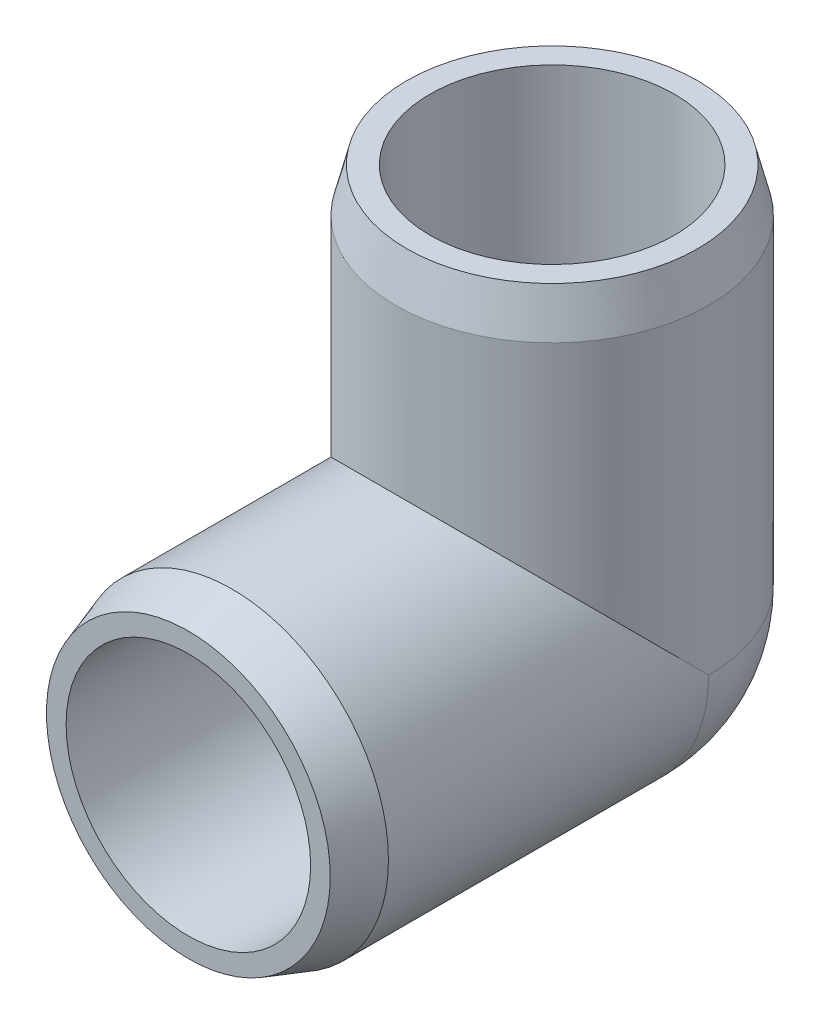
from build123d import *

# Parameters (mm, degrees)
BOSS_EXTRUDE2_REACH      = 67.644
BOSS_EXTRUDE2_END_RADIUS = 13.6525
SKETCH5_R                = 13.6525
SKETCH5_R_2              = 10.668
SKETCH6_R                = 10.668
CUT_EXTRUDE1_DEPTH       = 43.688
CUT_EXTRUDE2_START       = 44.196
SKETCH7_R                = 10.668
CUT_EXTRUDE2_DEPTH       = 44.196
SKETCH8_W                = 1.27
SKETCH8_H                = 1.905
SKETCH9_W                = 1.905
SKETCH9_H                = 1.27


with BuildPart() as part:
    # Sketch2 → Revolve1 (revolve)
    with BuildSketch(Plane.XY):
        with BuildLine():
            Line((13.6525, 13.6525), (13.6525, 45.4025))
            Line((13.6525, 45.4025), (10.668, 45.4025))
            Line((10.668, 45.4025), (10.668, 13.6525))
            ThreePointArc((10.668, 13.6525), (7.543415142, 6.109084858), (0, 2.9845))
            Line((0, 2.9845), (0, 0))
            ThreePointArc((0, 0), (9.65377533, 3.99872467), (13.6525, 13.6525))
        make_face()
    revolve(axis=Axis((0, 50.454853333, 0), (0, -1, 0)))

    # Boss-Extrude2: up to this sphere (the profile starts outside it)
    boss_extrude2_end = Location((0, 13.6525, 0)) * Sphere(BOSS_EXTRUDE2_END_RADIUS, mode=Mode.PRIVATE)
    # Sketch5 → Boss-Extrude2 (add, up to the surface)
    with BuildSketch(Plane(origin=(0, 0, 31.75), x_dir=(-1, 0, 0), z_dir=(0, 0, -1)), mode=Mode.PRIVATE) as boss_extrude2_sk1:
        with Locations((0, 13.6525)):
            Circle(SKETCH5_R)
        with Locations((0, 13.6525)):
            Circle(SKETCH5_R_2, mode=Mode.SUBTRACT)
    boss_extrude2_tool1 = extrude(boss_extrude2_sk1.sketch, amount=BOSS_EXTRUDE2_REACH, mode=Mode.PRIVATE) - boss_extrude2_end
    add(boss_extrude2_tool1.solids().sort_by_distance((13.266349, 13.6525, 31.75))[0])

    # Sketch6 → Cut-Extrude1 (cut)
    with BuildSketch(Plane(origin=(0, 13.6525, 0), x_dir=(1, 0, 0), z_dir=(0, 1, 0))):
        with Locations(Location((0, 0, 0), (0, 0, 270))):
            Circle(SKETCH6_R)
    extrude(amount=CUT_EXTRUDE1_DEPTH, mode=Mode.SUBTRACT)

    # Sketch7 → Cut-Extrude2 (cut)
    with BuildSketch(Plane.XY.offset(CUT_EXTRUDE2_START)):
        with Locations(Location((0, 13.6525, 0), (0, 0, 180))):
            Circle(SKETCH7_R)
    extrude(amount=-CUT_EXTRUDE2_DEPTH, mode=Mode.SUBTRACT)

    # Sketch8 → Revolve2 (revolve)
    with BuildSketch(Plane.XY, mode=Mode.PRIVATE) as revolve2_sk:
        with Locations((-10.033, 25.4)):
            Rectangle(SKETCH8_W, SKETCH8_H)
    revolve(revolve2_sk.sketch.rotate(Axis((0, 45.4025, 0), (0, -1, 0)), 270), axis=Axis((0, 45.4025, 0), (0, -1, 0)))

    # Sketch9 → Revolve3 (revolve)
    with BuildSketch(Plane(origin=(0, 0, 0), x_dir=(0, 0, -1), z_dir=(1, 0, 0)), mode=Mode.PRIVATE) as revolve3_sk:
        with Locations((-11.7475, 3.6195)):
            Rectangle(SKETCH9_W, SKETCH9_H)
    revolve(revolve3_sk.sketch.rotate(Axis((0, 13.6525, 31.75), (0, 0, -1)), 270), axis=Axis((0, 13.6525, 31.75), (0, 0, -1)))

    # Sketch10 → Cut-Revolve1 (revolve, cut)
    with BuildSketch(Plane(origin=(0, 0, 0), x_dir=(0, 0, -1), z_dir=(1, 0, 0)), mode=Mode.PRIVATE) as cut_revolve1_sk:
        Polygon((13.6525, 45.4025), (13.6525, 41.5925), (12.7, 45.4025), align=None)
    revolve(cut_revolve1_sk.sketch.rotate(Axis((0, 45.4025, 0), (0, -1, 0)), 180), axis=Axis((0, 45.4025, 0), (0, -1, 0)), mode=Mode.SUBTRACT)

    # Sketch12 → Cut-Revolve2 (revolve, cut)
    with BuildSketch(Plane(origin=(0, 13.6525, 0), x_dir=(1, 0, 0), z_dir=(0, 1, 0)), mode=Mode.PRIVATE) as cut_revolve2_sk:
        Polygon((-13.6525, -31.75), (-13.6525, -27.94), (-12.3825, -31.75), align=None)
    revolve(cut_revolve2_sk.sketch.rotate(Axis((0, 13.6525, 31.75), (0, 0, -1)), 180), axis=Axis((0, 13.6525, 31.75), (0, 0, -1)), mode=Mode.SUBTRACT)


solid = part.part
